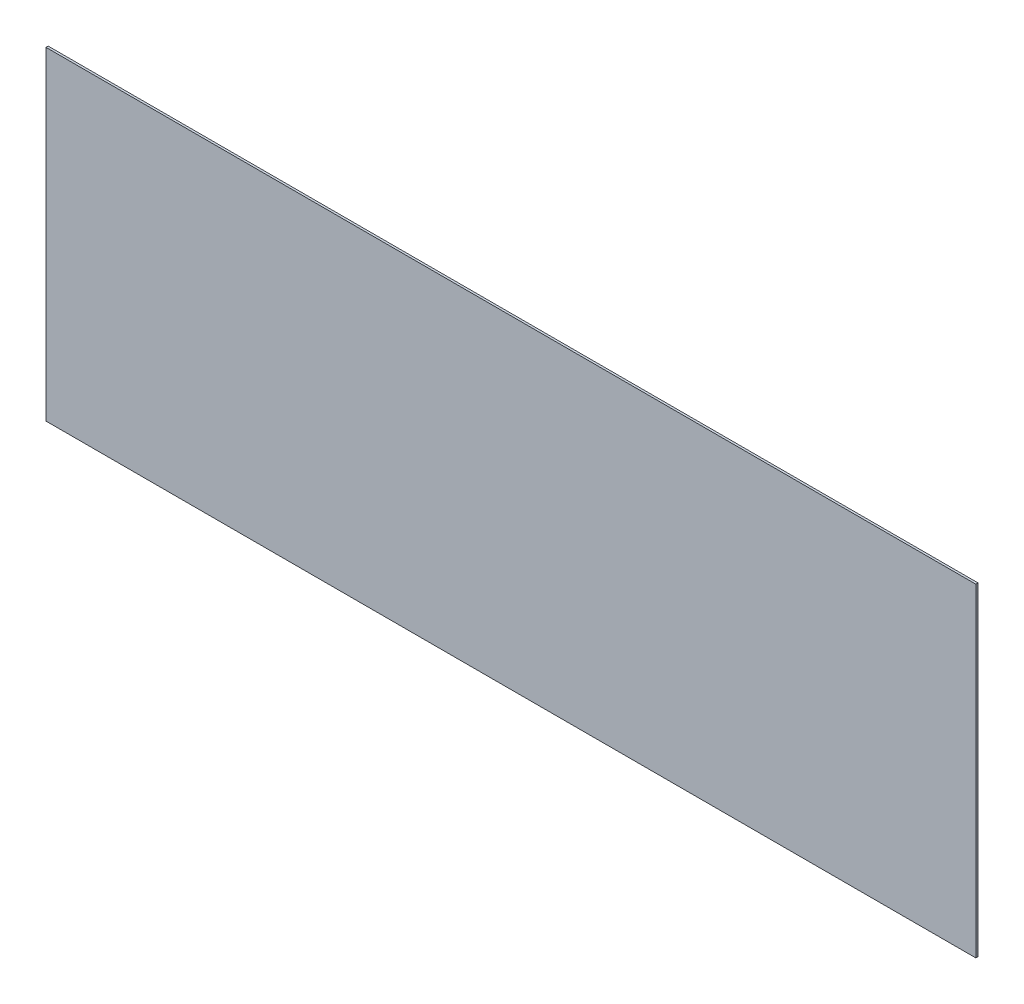
from build123d import *

# Parameters (mm, degrees)
SKETCH1_W           = 422.258451637
SKETCH1_H           = 147
BOSS_EXTRUDE1_DEPTH = 1


with BuildPart() as part:
    # Sketch1 → Boss-Extrude1 (new body)
    with BuildSketch(Plane.XY):
        with Locations((536.270774182, 73.5)):
            Rectangle(SKETCH1_W, SKETCH1_H)
    extrude(amount=BOSS_EXTRUDE1_DEPTH)


solid = part.part
